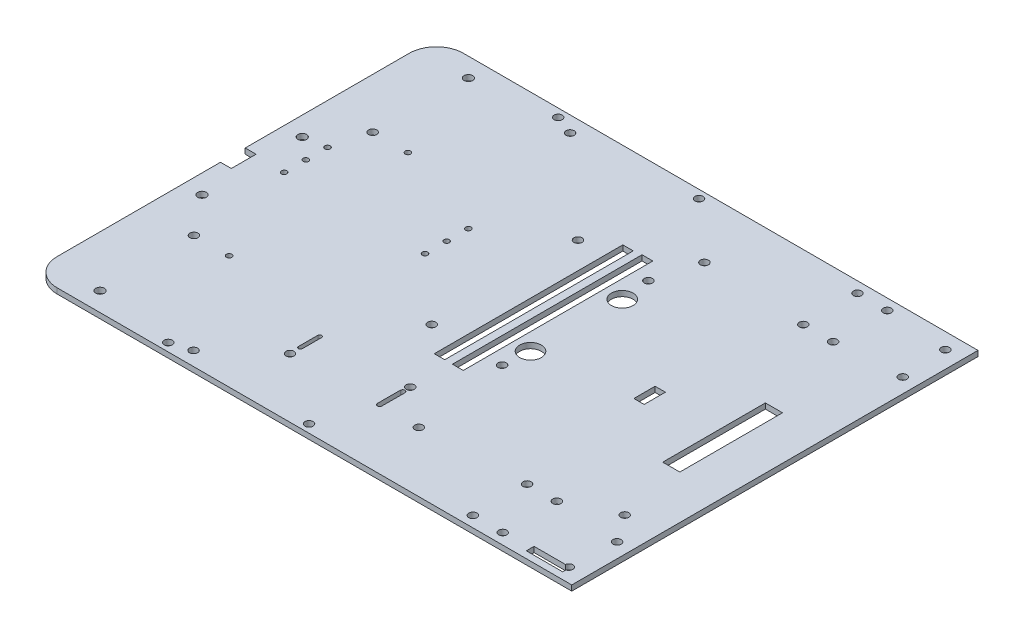
from build123d import *

# Parameters (mm, degrees)
SKETCH1_W           = 200
SKETCH1_H           = 150
BOSS_EXTRUDE2_DEPTH = 2
SKETCH2_R           = 1.5
CUT_EXTRUDE5_DEPTH  = 10
SKETCH4_R           = 1.5
SKETCH4_R_2         = 1
CUT_EXTRUDE6_DEPTH  = 10
SKETCH5_R           = 1.5
CUT_EXTRUDE7_DEPTH  = 2
SKETCH9_R           = 1.5
CUT_EXTRUDE8_DEPTH  = 2
SKETCH10_R          = 1.6
CUT_EXTRUDE9_DEPTH  = 2
SKETCH11_R          = 1.6
CUT_EXTRUDE10_DEPTH = 2
SKETCH13_R          = 1.5
SKETCH13_R_2        = 4
SKETCH13_W          = 3.852645584
SKETCH13_H          = 69.612656739
SKETCH13_W_2        = 4
SKETCH13_H_2        = 70
SKETCH13_H_3        = 9.133756838
CUT_EXTRUDE11_DEPTH = 2
SKETCH15_R          = 1.5
SKETCH15_W          = 13.437861814
SKETCH15_H          = 2.860791374
SKETCH15_W_2        = 3.802370222
SKETCH15_H_2        = 7.84152301
SKETCH15_W_3        = 6.323120029
SKETCH15_H_3        = 37.907431128
CUT_EXTRUDE13_DEPTH = 2
FILLET1_R           = 10


with BuildPart() as part:
    # Sketch1 → Boss-Extrude2 (new body)
    with BuildSketch(Plane(origin=(0, 0, 0), x_dir=(1, 0, 0), z_dir=(0, 1, 0))):
        Rectangle(SKETCH1_W, SKETCH1_H)
    extrude(amount=BOSS_EXTRUDE2_DEPTH)

    # Sketch2 → Cut-Extrude5 (cut)
    with BuildSketch(Plane(origin=(0, 2, 0), x_dir=(1, 0, 0), z_dir=(0, 1, 0))):
        with Locations(Location((59.5, 71, 0), (0, 0, 270))):
            Circle(SKETCH2_R)
        with Locations(Location((59.5, 51, 0), (0, 0, 270))):
            Circle(SKETCH2_R)
        with Locations(Location((70.5, 71, 0), (0, 0, 270))):
            Circle(SKETCH2_R)
        with Locations(Location((70.5, 51, 0), (0, 0, 270))):
            Circle(SKETCH2_R)
        with Locations(Location((70.5, -51, 0), (0, 0, 90))):
            Circle(SKETCH2_R)
        with Locations(Location((70.5, -71, 0), (0, 0, 90))):
            Circle(SKETCH2_R)
        with Locations(Location((59.5, -51, 0), (0, 0, 90))):
            Circle(SKETCH2_R)
        with Locations(Location((59.5, -71, 0), (0, 0, 90))):
            Circle(SKETCH2_R)
    extrude(amount=-CUT_EXTRUDE5_DEPTH, mode=Mode.SUBTRACT)

    # Sketch4 → Cut-Extrude6 (cut)
    with BuildSketch(Plane.XZ):
        with Locations(Location((-81.5, 33, 0), (0, 0, 270))):
            Circle(SKETCH4_R)
        with Locations(Location((-68.5, 33, 0), (0, 0, 270))):
            Circle(SKETCH4_R_2)
        with Locations(Location((-68.5, -33, 0), (0, 0, 270))):
            Circle(SKETCH4_R_2)
        with Locations(Location((-81.5, -33, 0), (0, 0, 270))):
            Circle(SKETCH4_R)
        with Locations(Location((-33, -19.828905718, 0), (0, 0, 270))):
            Circle(SKETCH4_R_2)
        with Locations(Location((-33, -11.828905718, 0), (0, 0, 270))):
            Circle(SKETCH4_R_2)
        with Locations(Location((-33, -3.828905718, 0), (0, 0, 270))):
            Circle(SKETCH4_R_2)
        with Locations(Location((-85, -19.828905718, 0), (0, 0, 270))):
            Circle(SKETCH4_R_2)
        with Locations(Location((-85, -11.828905718, 0), (0, 0, 270))):
            Circle(SKETCH4_R_2)
        with Locations(Location((-85, -3.828905718, 0), (0, 0, 270))):
            Circle(SKETCH4_R_2)
    extrude(amount=-CUT_EXTRUDE6_DEPTH, mode=Mode.SUBTRACT)

    # Sketch5 → Cut-Extrude7 (cut)
    with BuildSketch(Plane(origin=(0, 2, 0), x_dir=(1, 0, 0), z_dir=(0, 1, 0))):
        with Locations(Location((0, 72, 0), (0, 0, 270))):
            Circle(SKETCH5_R)
        with Locations(Location((0, -72, 0), (0, 0, 270))):
            Circle(SKETCH5_R)
    extrude(amount=-CUT_EXTRUDE7_DEPTH, mode=Mode.SUBTRACT)

    # Sketch9 → Cut-Extrude8 (cut)
    with BuildSketch(Plane(origin=(0, 2, 0), x_dir=(1, 0, 0), z_dir=(0, 1, 0))):
        with Locations(Location((-52, 72, 0), (0, 0, 270))):
            Circle(SKETCH9_R)
        with Locations(Location((-52, -72, 0), (0, 0, 270))):
            Circle(SKETCH9_R)
    extrude(amount=-CUT_EXTRUDE8_DEPTH, mode=Mode.SUBTRACT)

    # Sketch10 → Cut-Extrude9 (cut)
    with BuildSketch(Plane(origin=(0, 2, 0), x_dir=(1, 0, 0), z_dir=(0, 1, 0))):
        with Locations(Location((-93, -18.5, 0), (0, 0, 270))):
            Circle(SKETCH10_R)
        with Locations(Location((-93, 18.5, 0), (0, 0, 270))):
            Circle(SKETCH10_R)
    extrude(amount=-CUT_EXTRUDE9_DEPTH, mode=Mode.SUBTRACT)

    # Sketch11 → Cut-Extrude10 (cut)
    with BuildSketch(Plane(origin=(0, 2, 0), x_dir=(1, 0, 0), z_dir=(0, 1, 0))):
        with Locations(Location((-81.143811431, -68, 0), (0, 0, 270))):
            Circle(SKETCH11_R)
        with Locations(Location((-81.143811431, 68, 0), (0, 0, 90))):
            Circle(SKETCH11_R)
    extrude(amount=-CUT_EXTRUDE10_DEPTH, mode=Mode.SUBTRACT)

    # Sketch13 → Cut-Extrude11 (cut)
    with BuildSketch(Plane(origin=(0, 2, 0), x_dir=(1, 0, 0), z_dir=(0, 1, 0))):
        with Locations(Location((-9.119722343, -17.580925048, 0), (0, 0, 270))):
            Circle(SKETCH13_R)
        with Locations(Location((16.880277657, -17.580925048, 0), (0, 0, 270))):
            Circle(SKETCH13_R)
        with Locations(Location((16.880277657, 36.419074952, 0), (0, 0, 270))):
            Circle(SKETCH13_R)
        with Locations(Location((-9.119722343, 36.419074952, 0), (0, 0, 270))):
            Circle(SKETCH13_R)
        with Locations(Location((17.988437806, 25.654998333, 0), (0, 0, 270))):
            Circle(SKETCH13_R_2)
        with Locations(Location((17.688437806, -7.915084342, 0), (0, 0, 270))):
            Circle(SKETCH13_R_2)
        with Locations(Location((-44.803150728, 69.189910235, 0), (0, 0, 270))):
            Circle(SKETCH13_R)
        with Locations(Location((-44.803150728, -69.841742989, 0), (0, 0, 270))):
            Circle(SKETCH13_R)
        with Locations(Location((93.756523302, 69.189910235, 0), (0, 0, 270))):
            Circle(SKETCH13_R)
        with Locations(Location((93.756523302, -69.841742989, 0), (0, 0, 270))):
            Circle(SKETCH13_R)
        with Locations(Location((-25.963837205, -53.058732034, 0), (0, 0, 270))):
            Circle(SKETCH13_R)
        with Locations(Location((6.936162795, -41.558732034, 0), (0, 0, 270))):
            Circle(SKETCH13_R)
        with Locations((2.617967958, 8.35975515)):
            Rectangle(SKETCH13_W, SKETCH13_H)
        with Locations((9.395346995, 8.55342678)):
            Rectangle(SKETCH13_W_2, SKETCH13_H_2)
        with BuildLine():
            Line((-26.695563248, -49.204265927), (-26.695563248, -42.058732034))
            ThreePointArc((-26.695563248, -42.058732034), (-25.981772316, -41.344941102), (-25.267981384, -42.058732034))
            Line((-25.267981384, -42.058732034), (-25.267981384, -49.204265927))
            ThreePointArc((-25.267981384, -49.204265927), (-25.981772316, -49.918056859), (-26.695563248, -49.204265927))
        make_face()
        with BuildLine():
            Line((7.769268237, -44.388583851), (7.74483734, -52.845558713))
            ThreePointArc((7.74483734, -52.845558713), (6.909325186, -53.676257441), (6.078626457, -52.840745287))
            Line((6.078626457, -52.840745287), (6.103057354, -44.383770425))
            ThreePointArc((6.103057354, -44.383770425), (6.938569508, -43.553071697), (7.769268237, -44.388583851))
        make_face()
        with Locations((-98, -0.126177239)):
            Rectangle(SKETCH13_W_2, SKETCH13_H_3)
    extrude(amount=-CUT_EXTRUDE11_DEPTH, mode=Mode.SUBTRACT)

    # Sketch15 → Cut-Extrude13 (cut)
    with BuildSketch(Plane.XZ):
        with Locations(Location((87.421507423, 42.879986954, 0), (0, 0, 270))):
            Circle(SKETCH15_R)
        with Locations(Location((94.605250478, -52.59625709, 0), (0, 0, 270))):
            Circle(SKETCH15_R)
        with Locations(Location((94.605250478, 52.856409291, 0), (0, 0, 270))):
            Circle(SKETCH15_R)
        with Locations(Location((21.394749522, -52.59625709, 0), (0, 0, 270))):
            Circle(SKETCH15_R)
        with Locations(Location((21.394749522, 52.856409291, 0), (0, 0, 270))):
            Circle(SKETCH15_R)
        with Locations((87.421507423, 71.051456506)):
            Rectangle(SKETCH15_W, SKETCH15_H)
        with Locations((53.759388105, 0)):
            Rectangle(SKETCH15_W_2, SKETCH15_H_2)
        with Locations((80.702576515, 0)):
            Rectangle(SKETCH15_W_3, SKETCH15_H_3)
    extrude(amount=-CUT_EXTRUDE13_DEPTH, mode=Mode.SUBTRACT)

    # Fillet1
    fillet1_edges = [part.edges().sort_by_distance(p)[0] for p in [
        (-100, 1, 75),
        (-100, 1, -75),
    ]]
    fillet(fillet1_edges, radius=FILLET1_R)


solid = part.part
